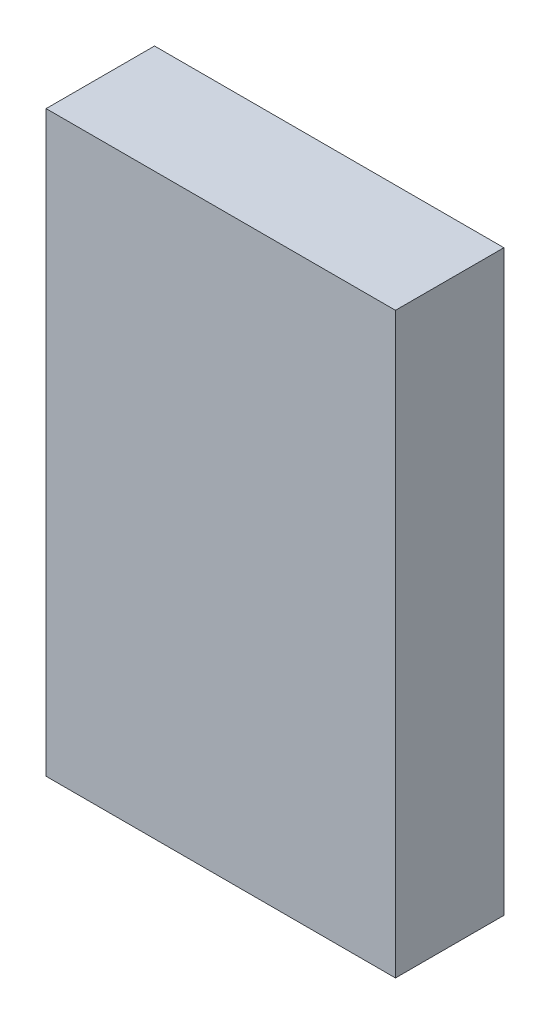
from build123d import *

# Parameters (mm, degrees)
SKETCH1_W           = 73.66
SKETCH1_H           = 121.92
BOSS_EXTRUDE1_DEPTH = 22.86


with BuildPart() as part:
    # Sketch1 → Boss-Extrude1 (new body)
    with BuildSketch(Plane.XY):
        Rectangle(SKETCH1_W, SKETCH1_H)
    extrude(amount=BOSS_EXTRUDE1_DEPTH)


solid = part.part
